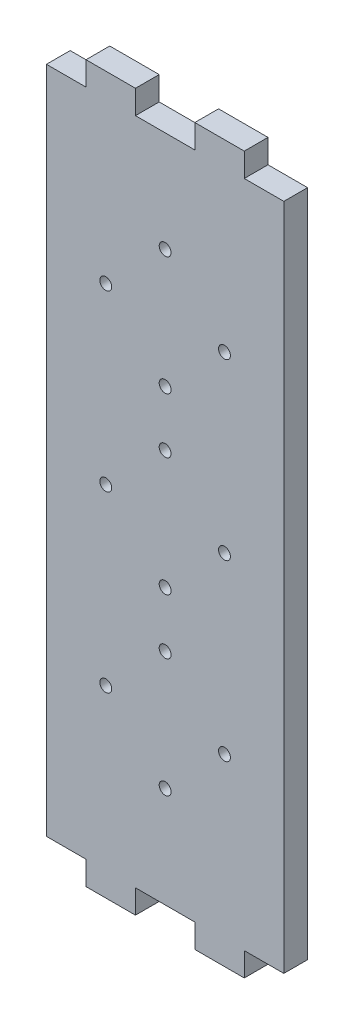
from build123d import *

# Parameters (mm, degrees)
SKETCH1_R           = 0.75
BOSS_EXTRUDE1_DEPTH = 3


with BuildPart() as part:
    # Sketch1 → Boss-Extrude1 (new body)
    with BuildSketch(Plane.XY):
        Polygon((-15, 42.25), (-10, 42.25), (-10, 45.25), (-3.75, 45.25), (-3.75, 42.25), (3.75, 42.25), (3.75, 45.25), (10, 45.25), (10, 42.25), (15, 42.25), (15, -42.25), (10, -42.25), (10, -45.25), (3.75, -45.25), (3.75, -42.25), (-3.75, -42.25), (-3.75, -45.25), (-10, -45.25), (-10, -42.25), (-15, -42.25), align=None)
        with Locations((0, 29.5)):
            Circle(SKETCH1_R, mode=Mode.SUBTRACT)
        with Locations((7.5, 22)):
            Circle(SKETCH1_R, mode=Mode.SUBTRACT)
        with Locations((0, 14.5)):
            Circle(SKETCH1_R, mode=Mode.SUBTRACT)
        with Locations((-7.5, 22)):
            Circle(SKETCH1_R, mode=Mode.SUBTRACT)
        with Locations((0, 7.5)):
            Circle(SKETCH1_R, mode=Mode.SUBTRACT)
        with Locations((-7.5, 0)):
            Circle(SKETCH1_R, mode=Mode.SUBTRACT)
        with Locations((0, -7.5)):
            Circle(SKETCH1_R, mode=Mode.SUBTRACT)
        with Locations((7.5, 0)):
            Circle(SKETCH1_R, mode=Mode.SUBTRACT)
        with Locations((0, -14.5)):
            Circle(SKETCH1_R, mode=Mode.SUBTRACT)
        with Locations((-7.5, -22)):
            Circle(SKETCH1_R, mode=Mode.SUBTRACT)
        with Locations((0, -29.5)):
            Circle(SKETCH1_R, mode=Mode.SUBTRACT)
        with Locations((7.5, -22)):
            Circle(SKETCH1_R, mode=Mode.SUBTRACT)
    extrude(amount=BOSS_EXTRUDE1_DEPTH)


solid = part.part
